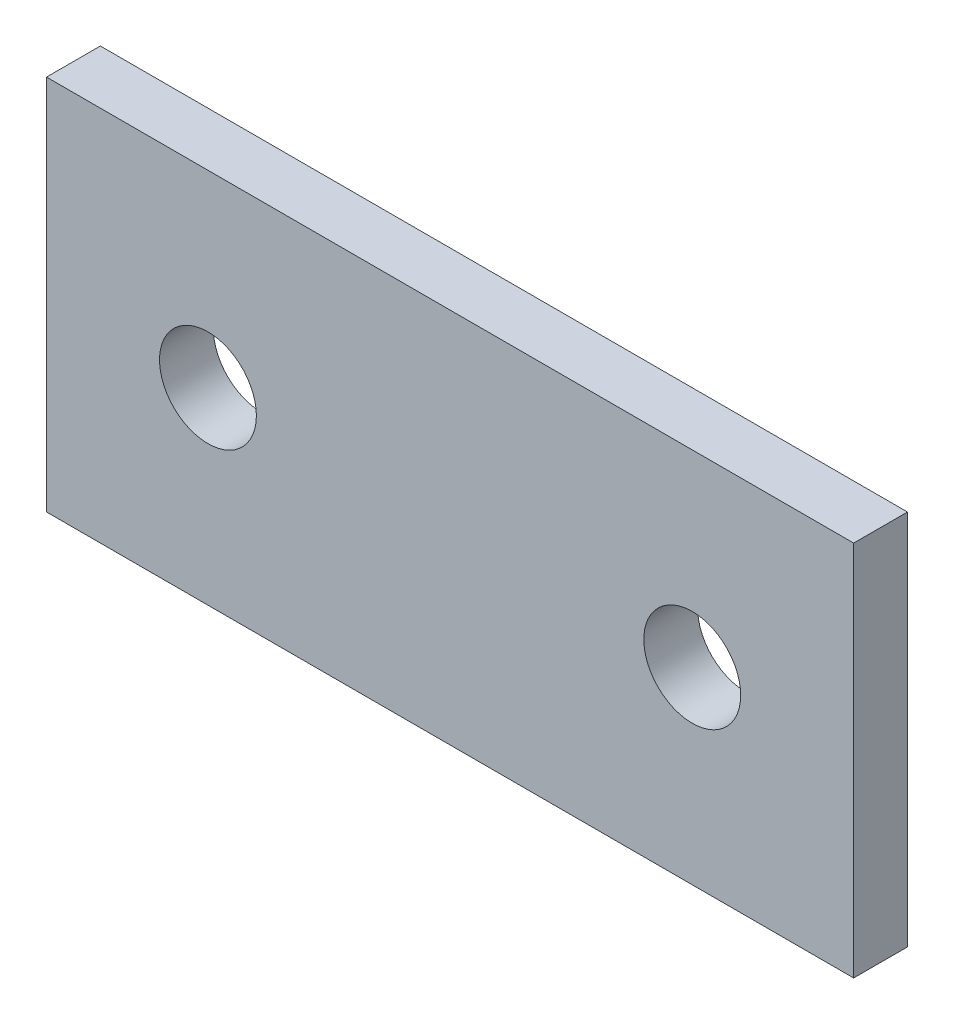
from build123d import *

# Parameters (mm, degrees)
SKETCH1_W           = 150
SKETCH1_H           = 70
SKETCH1_R           = 9
BOSS_EXTRUDE1_DEPTH = 5


with BuildPart() as part:
    # Sketch1 → Boss-Extrude1 (new, symmetric)
    with BuildSketch(Plane.XY):
        Rectangle(SKETCH1_W, SKETCH1_H)
        with Locations((45, 0)):
            Circle(SKETCH1_R, mode=Mode.SUBTRACT)
        with Locations((-45, 0)):
            Circle(SKETCH1_R, mode=Mode.SUBTRACT)
    extrude(amount=BOSS_EXTRUDE1_DEPTH, both=True)


solid = part.part
